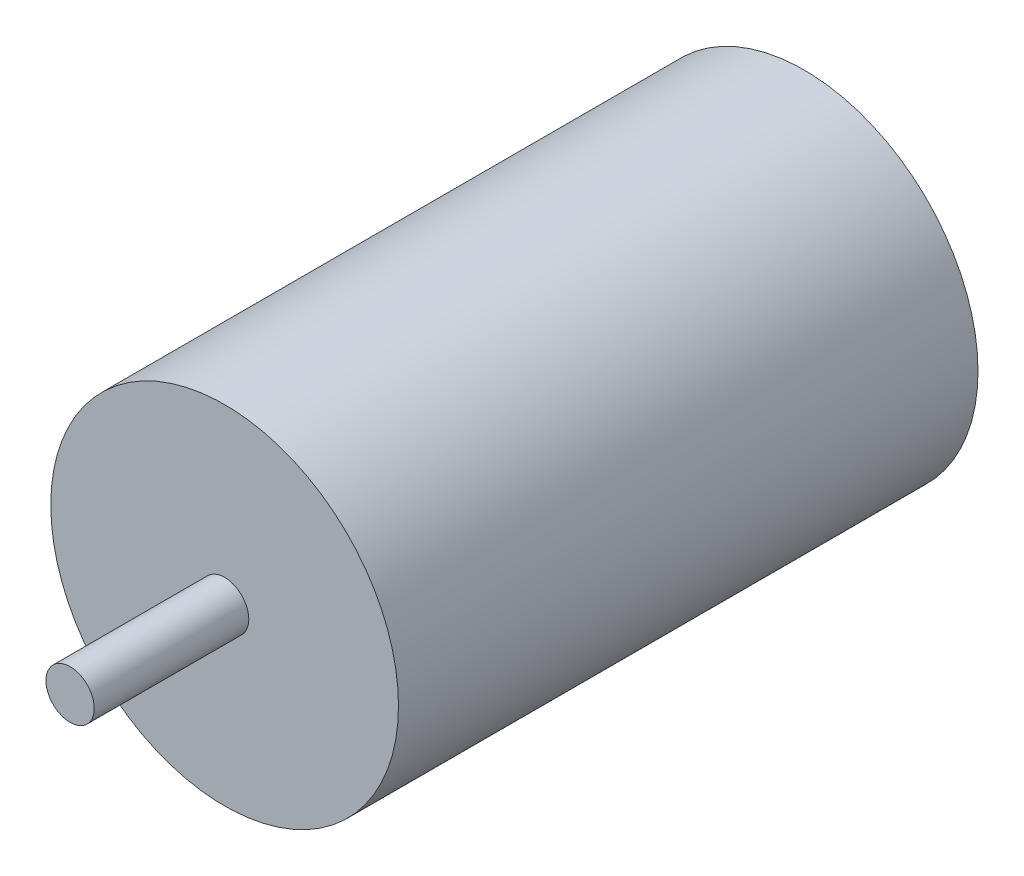
from build123d import *

# Parameters (mm, degrees)
SKETCH1_R           = 18
BOSS_EXTRUDE1_DEPTH = 60
SKETCH2_R           = 2.5
BOSS_EXTRUDE2_DEPTH = 16


with BuildPart() as part:
    # Sketch1 → Boss-Extrude1 (new body)
    with BuildSketch(Plane.XY):
        Circle(SKETCH1_R)
    extrude(amount=BOSS_EXTRUDE1_DEPTH)

    # Sketch2 → Boss-Extrude2 (add)
    with BuildSketch(Plane.XY.offset(60)):
        Circle(SKETCH2_R)
    extrude(amount=BOSS_EXTRUDE2_DEPTH)


solid = part.part
